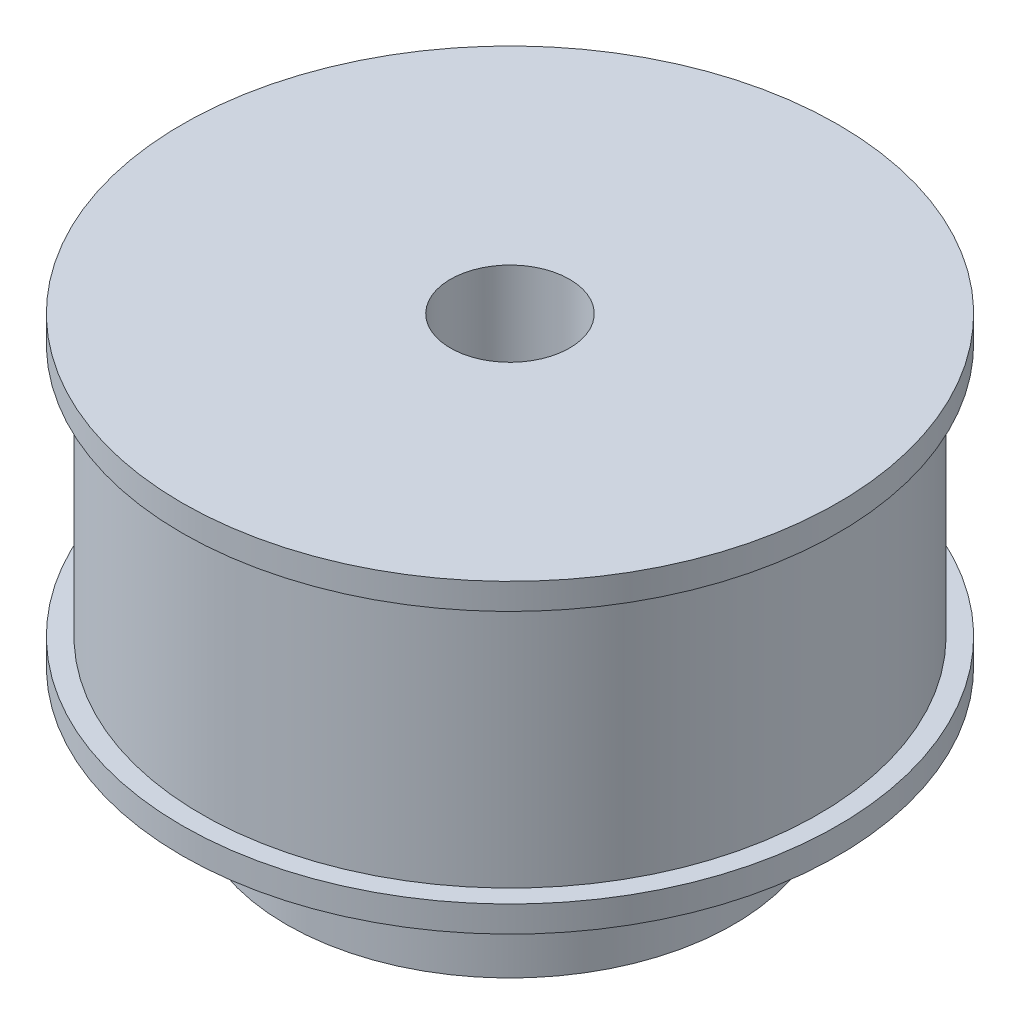
from build123d import *

# Parameters (mm, degrees)
SKETCH5_R          = 2
CUT_EXTRUDE4_DEPTH = 18
SKETCH6_R          = 2
CUT_EXTRUDE5_DEPTH = 18


with BuildPart() as part:
    # Sketch1 → Revolve1 (revolve)
    with BuildSketch(Plane.XY, mode=Mode.PRIVATE) as revolve1_sk:
        Polygon((4, 0), (15, 0), (15, 7.5), (22, 7.5), (22, 9.25), (20.69, 9.25), (20.69, 26.25), (22, 26.25), (22, 28), (4, 28), align=None)
    revolve(revolve1_sk.sketch.rotate(Axis((0, 0, 0), (0, 1, 0)), 90), axis=Axis((0, 0, 0), (0, 1, 0)))

    # Sketch5 → Cut-Extrude4 (cut)
    with BuildSketch(Plane.XY):
        with Locations(Location((0, 3.526654559, 0), (0, 0, 270.000000001))):
            Circle(SKETCH5_R)
    extrude(amount=-CUT_EXTRUDE4_DEPTH, mode=Mode.SUBTRACT)

    # Sketch6 → Cut-Extrude5 (cut)
    with BuildSketch(Plane(origin=(0, 0, 0), x_dir=(0, 0, -1), z_dir=(1, 0, 0))):
        with Locations((0, 3.75)):
            Circle(SKETCH6_R)
    extrude(amount=-CUT_EXTRUDE5_DEPTH, mode=Mode.SUBTRACT)


solid = part.part
